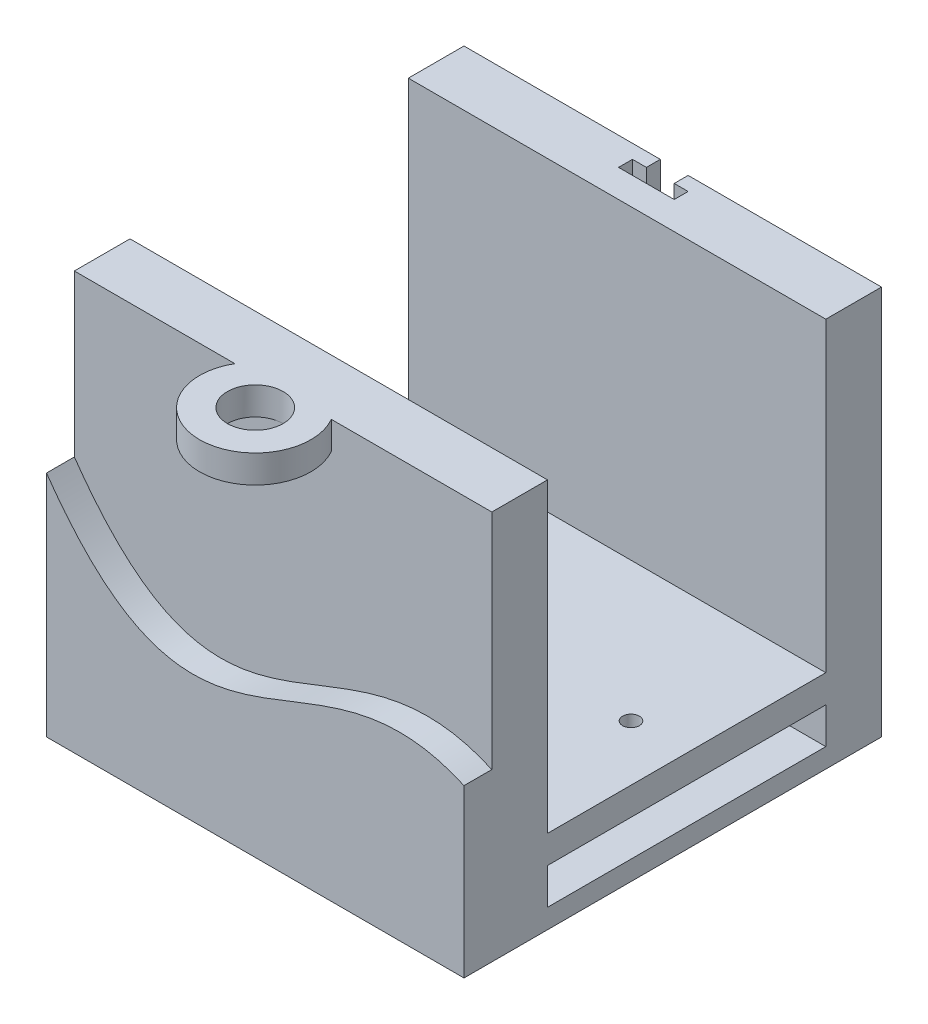
from build123d import *

# Parameters (mm, degrees)
SKETCH_2_W          = 150
SKETCH_2_H          = 140
EXTRUDE_1_DEPTH     = 140
SKETCH_3_W          = 150
SKETCH_3_H          = 100
CUT_EXTRUDE_1_DEPTH = 110
SKETCH_4_W          = 100
SKETCH_4_H          = 13
CUT_EXTRUDE_2_DEPTH = 231.131739112
SKETCH_5_R          = 3
CUT_EXTRUDE_3_DEPTH = 50
SKETCH_6_R          = 3
CUT_EXTRUDE_4_DEPTH = 177.679477459
SKETCH_7_R          = 20
SKETCH_7_R_2        = 10
EXTRUDE_1_2_DEPTH   = 10
SKETCH_8_W          = 10
SKETCH_8_H          = 10
CUT_EXTRUDE_5_DEPTH = 120
SKETCH_10_W         = 20
SKETCH_10_H         = 5
CUT_EXTRUDE_7_DEPTH = 120
EXTRUDE_2_DEPTH     = 10


with BuildPart() as part:
    # 草圖2 → Extrude 1 (new body)
    with BuildSketch(Plane(origin=(0, 0, 0), x_dir=(1, 0, 0), z_dir=(0, 1, 0))):
        with Locations((15.857142857, -34.214285714)):
            Rectangle(SKETCH_2_W, SKETCH_2_H)
    extrude(amount=EXTRUDE_1_DEPTH)

    # 草圖3 → 除料-伸長1 (cut)
    with BuildSketch(Plane(origin=(0, 140, 0), x_dir=(1, 0, 0), z_dir=(0, 1, 0))):
        with Locations((15.857142857, -34.214285714)):
            Rectangle(SKETCH_3_W, SKETCH_3_H)
    extrude(amount=-CUT_EXTRUDE_1_DEPTH, mode=Mode.SUBTRACT)

    # 草圖4 → 除料-伸長2 (cut, through all)
    with BuildSketch(Plane(origin=(90.857142857, 0, 0), x_dir=(0, 0, -1), z_dir=(1, 0, 0))):
        with Locations((-34.214285714, 13.5)):
            Rectangle(SKETCH_4_W, SKETCH_4_H)
    extrude(amount=-CUT_EXTRUDE_2_DEPTH, mode=Mode.SUBTRACT)

    # 草圖5 → 除料-伸長3 (cut)
    with BuildSketch(Plane(origin=(0, 30, 0), x_dir=(1, 0, 0), z_dir=(0, 1, 0))):
        with Locations(Location((70.857142857, -34.214285714, 0), (0, 0, 270))):
            Circle(SKETCH_5_R)
    extrude(amount=-CUT_EXTRUDE_3_DEPTH, mode=Mode.SUBTRACT)

    # 草圖6 → 除料-伸長4 (cut, through all)
    with BuildSketch(Plane(origin=(0, 30, 0), x_dir=(1, 0, 0), z_dir=(0, 1, 0))):
        with Locations(Location((-29.142857143, -34.214285714, 0), (0, 0, 270))):
            Circle(SKETCH_6_R)
    extrude(amount=-CUT_EXTRUDE_4_DEPTH, mode=Mode.SUBTRACT)

    # 草圖7 → Extrude 1 2 (add)
    with BuildSketch(Plane(origin=(0, 140, 0), x_dir=(1, 0, 0), z_dir=(0, 1, 0))):
        with Locations((15.857142857, -114.214285714)):
            Circle(SKETCH_7_R)
        with Locations((15.857142857, -114.214285714)):
            Circle(SKETCH_7_R_2, mode=Mode.SUBTRACT)
    extrude(amount=-EXTRUDE_1_2_DEPTH)

    # 草圖8 → 除料-伸長5 (cut)
    with BuildSketch(Plane(origin=(0, 140, 0), x_dir=(1, 0, 0), z_dir=(0, 1, 0))):
        with Locations((16.382857537, 30.785714286)):
            Rectangle(SKETCH_8_W, SKETCH_8_H)
    extrude(amount=-CUT_EXTRUDE_5_DEPTH, mode=Mode.SUBTRACT)

    # 草圖10 → 除料-伸長7 (cut)
    with BuildSketch(Plane(origin=(0, 140, 0), x_dir=(1, 0, 0), z_dir=(0, 1, 0))):
        with Locations((16.382857537, 28.285714286)):
            Rectangle(SKETCH_10_W, SKETCH_10_H)
    extrude(amount=-CUT_EXTRUDE_7_DEPTH, mode=Mode.SUBTRACT)

    # 草圖11 → 填料-伸長2 (add)
    with BuildSketch(Plane.XY.offset(104.214285714)):
        with BuildLine():
            Line((-59.142857143, 82.136050004), (-59.142857143, 0))
            Line((-59.142857143, 0), (90.857142857, 0))
            Line((90.857142857, 0), (90.857142857, 59.85891712))
            add(Edge.make_bspline(
                [(-59.142857143, 82.136050004), (-2.260684415, 0.574504188), (33.520042851, 85.660046613), (90.857142857, 59.85891712)],
                knots=[0, 0, 0, 0, 1, 1, 1, 1], degree=3))
        make_face()
    extrude(amount=EXTRUDE_2_DEPTH)


solid = part.part
